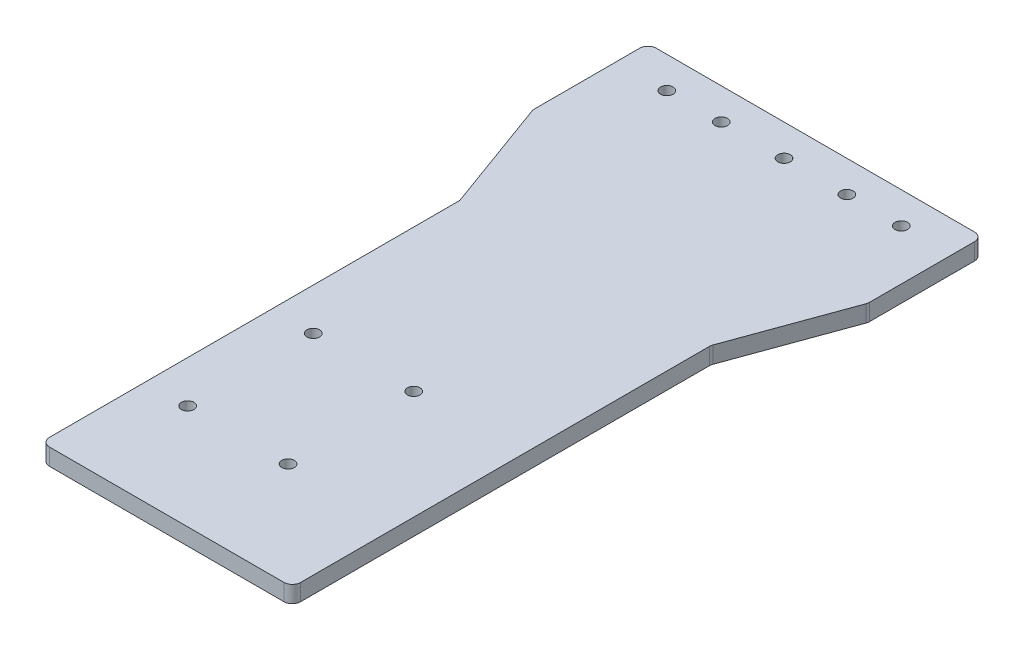
from build123d import *

# Parameters (mm, degrees)
EXTRUDE_1_DEPTH     = 4
SKETCH_2_R          = 1.5
CUT_EXTRUDE_1_DEPTH = 4
SKETCH_3_R          = 1.5
CUT_EXTRUDE_2_DEPTH = 4


with BuildPart() as part:
    # 草图1 → 凸台-拉伸1 (new body)
    with BuildSketch(Plane(origin=(0, 0, 0), x_dir=(1, 0, 0), z_dir=(0, 1, 0))):
        with BuildLine():
            Line((-0.120614758, 100.331386325), (-9.879385242, 127.143387869))
            ThreePointArc((-9.879385242, 127.143387869), (-9.969615506, 127.480131801), (-10, 127.827428156))
            Line((-10, 127.827428156), (-10, 152.949548389))
            ThreePointArc((-10, 152.949548389), (-9.414213562, 154.363761951), (-8, 154.949548389))
            Line((-8, 154.949548389), (68, 154.949548389))
            ThreePointArc((68, 154.949548389), (69.414213562, 154.363761951), (70, 152.949548389))
            Line((70, 152.949548389), (70, 127.827428156))
            ThreePointArc((70, 127.827428156), (69.969615506, 127.480131801), (69.879385242, 127.143387869))
            Line((69.879385242, 127.143387869), (60.120614758, 100.331386325))
            ThreePointArc((60.120614758, 100.331386325), (60.030384494, 99.994642394), (60, 99.647346039))
            Line((60, 99.647346039), (60, 2))
            ThreePointArc((60, 2), (59.414213562, 0.585786438), (58, 0))
            Line((58, 0), (2, 0))
            ThreePointArc((2, 0), (0.585786438, 0.585786438), (0, 2))
            Line((0, 2), (0, 99.647346039))
            ThreePointArc((0, 99.647346039), (-0.030384494, 99.994642394), (-0.120614758, 100.331386325))
        make_face()
    extrude(amount=EXTRUDE_1_DEPTH)

    # 草图2 → 切除-拉伸1 (cut)
    with BuildSketch(Plane(origin=(0, 4, 0), x_dir=(1, 0, 0), z_dir=(0, 1, 0))):
        with Locations(Location((10, 25, 0), (0, 0, 270))):
            Circle(SKETCH_2_R)
        with Locations(Location((34, 25, 0), (0, 0, 270))):
            Circle(SKETCH_2_R)
        with Locations(Location((34, 55, 0), (0, 0, 270))):
            Circle(SKETCH_2_R)
        with Locations(Location((10, 55, 0), (0, 0, 270))):
            Circle(SKETCH_2_R)
    extrude(amount=-CUT_EXTRUDE_1_DEPTH, mode=Mode.SUBTRACT)

    # 草图3 → 切除-拉伸2 (cut)
    with BuildSketch(Plane(origin=(0, 4, 0), x_dir=(1, 0, 0), z_dir=(0, 1, 0))):
        with Locations(Location((2, 147.449548389, 0), (0, 0, 270))):
            Circle(SKETCH_3_R)
        with Locations(Location((15, 147.449548389, 0), (0, 0, 270))):
            Circle(SKETCH_3_R)
        with Locations(Location((45, 147.449548389, 0), (0, 0, 90))):
            Circle(SKETCH_3_R)
        with Locations(Location((58, 147.449548389, 0), (0, 0, 90))):
            Circle(SKETCH_3_R)
        with Locations(Location((30, 147.449548389, 0), (0, 0, 270))):
            Circle(SKETCH_3_R)
    extrude(amount=-CUT_EXTRUDE_2_DEPTH, mode=Mode.SUBTRACT)


solid = part.part
